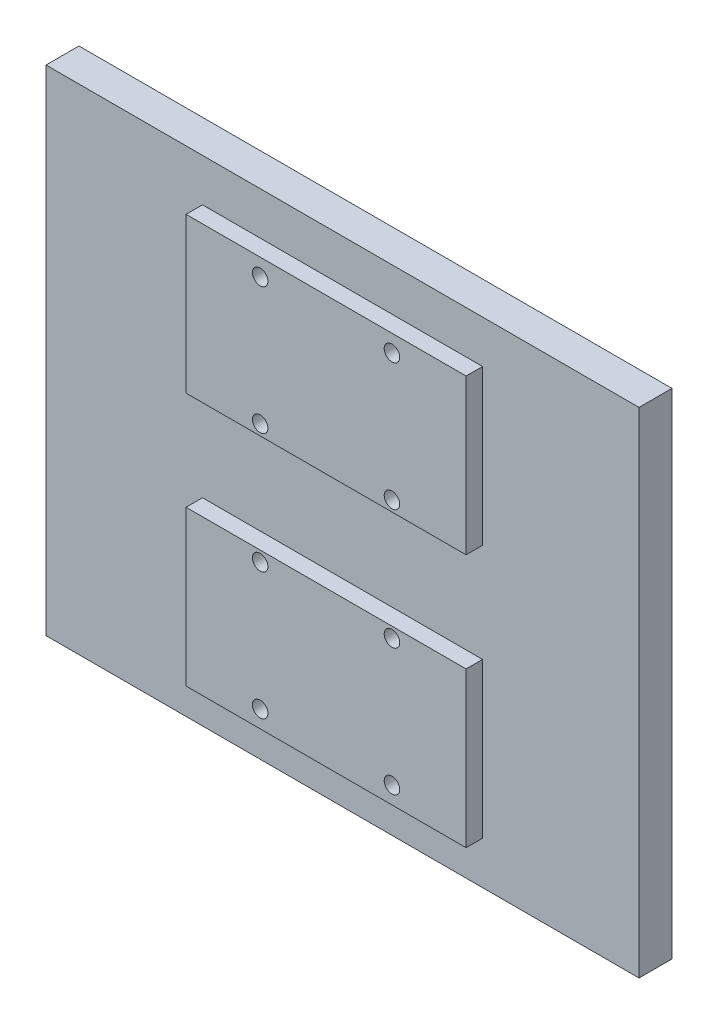
from build123d import *

# Parameters (mm, degrees)
SKIZZE1_W                       = 180
SKIZZE1_H                       = 150
AUFSATZ_LINEAR_AUSTRAGEN1_DEPTH = 10
SKIZZE2_W                       = 85
SKIZZE2_H                       = 47
AUFSATZ_LINEAR_AUSTRAGEN2_DEPTH = 5
SKIZZE4_R                       = 2.35
SCHNITT_LINEAR_AUSTRAGEN1_DEPTH = 119.11011811
SKIZZE5_R                       = 4.5
SCHNITT_LINEAR_AUSTRAGEN2_DEPTH = 9


with BuildPart() as part:
    # Skizze1 → Aufsatz-Linear austragen1 (new body)
    with BuildSketch(Plane.XY):
        Rectangle(SKIZZE1_W, SKIZZE1_H)
    extrude(amount=AUFSATZ_LINEAR_AUSTRAGEN1_DEPTH)

    # Skizze2 → Aufsatz-Linear austragen2 (add)
    with BuildSketch(Plane.XY.offset(10)):
        with Locations((0, 38.5)):
            Rectangle(SKIZZE2_W, SKIZZE2_H)
    aufsatz_linear_austragen2 = extrude(amount=AUFSATZ_LINEAR_AUSTRAGEN2_DEPTH)

    # Skizze4 → Schnitt-Linear austragen1 (cut, symmetric)
    with BuildSketch(Plane.XY.offset(15)):
        with Locations((-20, 56.8)):
            Circle(SKIZZE4_R)
        with Locations((-20, 18.2)):
            Circle(SKIZZE4_R)
        with Locations((20, 56.8)):
            Circle(SKIZZE4_R)
        with Locations((20, 18.2)):
            Circle(SKIZZE4_R)
    schnitt_linear_austragen1 = extrude(amount=SCHNITT_LINEAR_AUSTRAGEN1_DEPTH, both=True, mode=Mode.SUBTRACT)

    # Skizze5 → Schnitt-Linear austragen2 (cut)
    with BuildSketch(Plane(origin=(0, 0, 0), x_dir=(-1, 0, 0), z_dir=(0, 0, -1))):
        with Locations((-20, 56.8)):
            Circle(SKIZZE5_R)
        with Locations((20, 56.8)):
            Circle(SKIZZE5_R)
        with Locations((20, 18.2)):
            Circle(SKIZZE5_R)
        with Locations((-20, 18.2)):
            Circle(SKIZZE5_R)
    schnitt_linear_austragen2 = extrude(amount=-SCHNITT_LINEAR_AUSTRAGEN2_DEPTH, mode=Mode.SUBTRACT)

    # Spiegeln8: Aufsatz-Linear austragen2, Schnitt-Linear austragen1, Schnitt-Linear austragen2 across plane
    add(aufsatz_linear_austragen2.mirror(Plane.ZX))
    add(schnitt_linear_austragen1.mirror(Plane.ZX), mode=Mode.SUBTRACT)
    add(schnitt_linear_austragen2.mirror(Plane.ZX), mode=Mode.SUBTRACT)


solid = part.part
